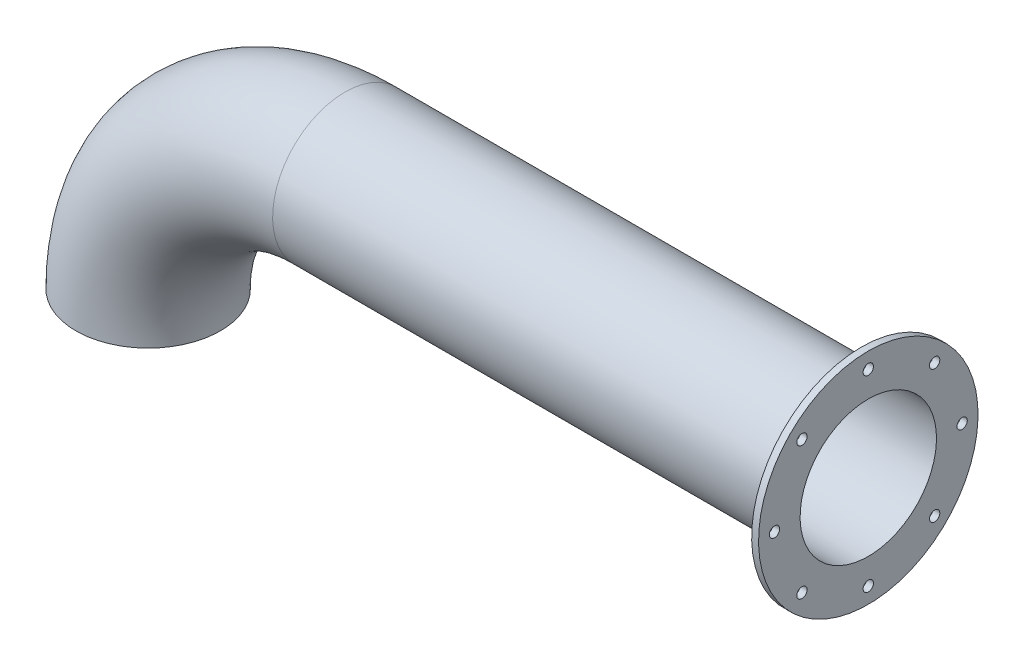
from build123d import *

# Parameters (mm, degrees)
SKETCH1_R           = 84
SKETCH1_R_2         = 79.22
SKETCH3_R           = 84
SKETCH3_R_2         = 79.22
BOSS_EXTRUDE1_DEPTH = 600
SKETCH4_R           = 127.5
SKETCH4_R_2         = 79.22
SKETCH4_R_3         = 6
BOSS_EXTRUDE2_DEPTH = 8


with BuildPart() as part:
    # Sweep1: sweep along a path in Sketch2
    with BuildLine(Plane.XY) as sweep1_path:
        ThreePointArc((0, 0), (66.955389821, 161.644610179), (228.6, 228.6))
    # Sketch1 → Sweep1 (sweep)
    with BuildSketch(Plane(origin=(0, 0, 0), x_dir=(1, 0, 0), z_dir=(0, 1, 0))):
        Circle(SKETCH1_R)
        Circle(SKETCH1_R_2, mode=Mode.SUBTRACT)
    sweep(path=sweep1_path.line)

    # Sketch3 → Boss-Extrude1 (add)
    with BuildSketch(Plane(origin=(228.6, 0, 0), x_dir=(0, 0, -1), z_dir=(1, 0, 0))):
        with Locations(Location((0, 228.6, 0), (0, 0, 90))):
            Circle(SKETCH3_R)
        with Locations(Location((0, 228.6, 0), (0, 0, 90))):
            Circle(SKETCH3_R_2, mode=Mode.SUBTRACT)
    extrude(amount=BOSS_EXTRUDE1_DEPTH)

    # Sketch4 → Boss-Extrude2 (add)
    with BuildSketch(Plane(origin=(828.6, 0, 0), x_dir=(0, 0, -1), z_dir=(1, 0, 0))):
        with Locations(Location((0, 228.6, 0), (0, 0, 90))):
            Circle(SKETCH4_R)
        with Locations(Location((0, 228.6, 0), (0, 0, 90))):
            Circle(SKETCH4_R_2, mode=Mode.SUBTRACT)
        with Locations(Location((0, 337.6, 0), (0, 0, 90))):
            Circle(SKETCH4_R_3, mode=Mode.SUBTRACT)
        with Locations(Location((77.074639149, 305.674639149, 0), (0, 0, 90))):
            Circle(SKETCH4_R_3, mode=Mode.SUBTRACT)
        with Locations(Location((109, 228.6, 0), (0, 0, 90))):
            Circle(SKETCH4_R_3, mode=Mode.SUBTRACT)
        with Locations(Location((77.074639149, 151.525360851, 0), (0, 0, 90))):
            Circle(SKETCH4_R_3, mode=Mode.SUBTRACT)
        with Locations(Location((0, 119.6, 0), (0, 0, 90))):
            Circle(SKETCH4_R_3, mode=Mode.SUBTRACT)
        with Locations(Location((-77.074639149, 151.525360851, 0), (0, 0, 90))):
            Circle(SKETCH4_R_3, mode=Mode.SUBTRACT)
        with Locations(Location((-109, 228.6, 0), (0, 0, 90))):
            Circle(SKETCH4_R_3, mode=Mode.SUBTRACT)
        with Locations(Location((-77.074639149, 305.674639149, 0), (0, 0, 90))):
            Circle(SKETCH4_R_3, mode=Mode.SUBTRACT)
    extrude(amount=BOSS_EXTRUDE2_DEPTH)


solid = part.part
